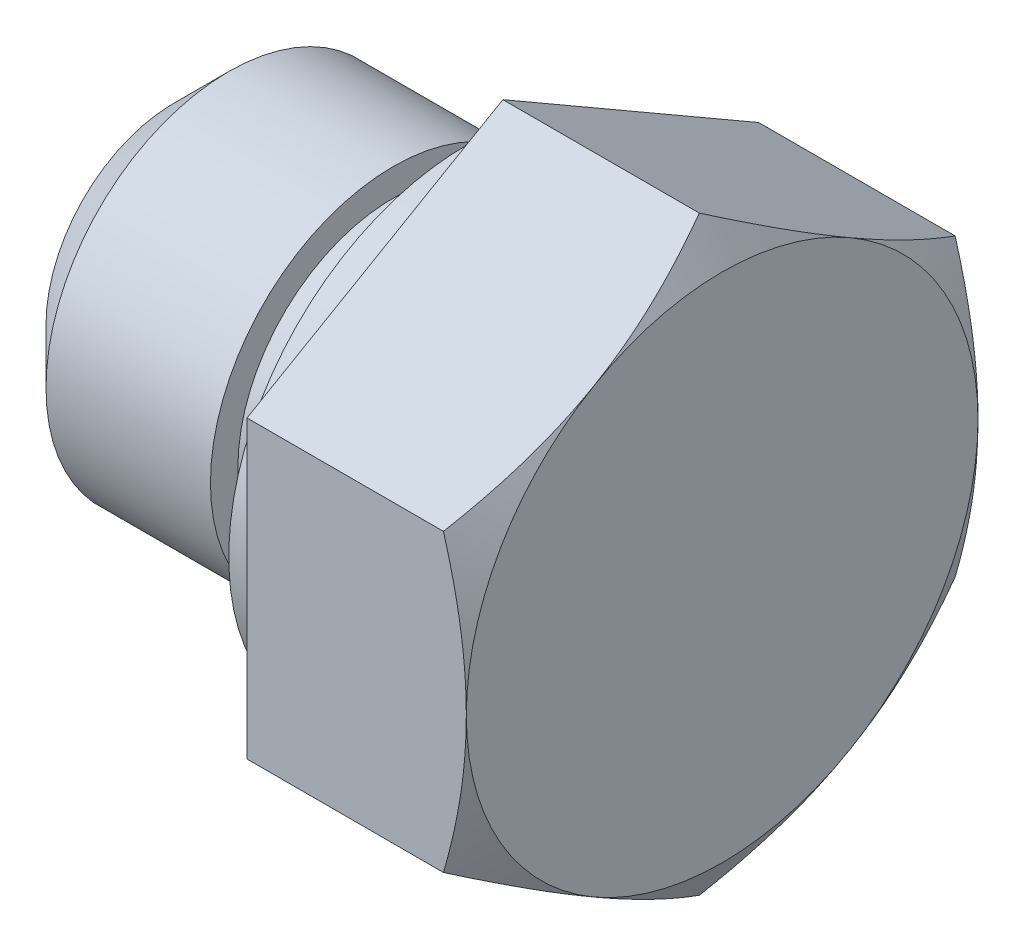
from build123d import *

# Parameters (mm, degrees)
EXTRUDE_1_DEPTH = 6
CHAMFER_1_SIZE  = 1.5


with BuildPart() as part:
    # 草图1 → 凸台-拉伸1 (new body)
    with BuildSketch(Plane(origin=(0, 0, 0), x_dir=(0, 0, -1), z_dir=(1, 0, 0))):
        Polygon((0, 8.082903769), (7, 4.041451884), (7, -4.041451884), (0, -8.082903769), (-7, -4.041451884), (-7, 4.041451884), align=None)
    extrude(amount=-EXTRUDE_1_DEPTH)

    # 草图3 → 旋转1 (revolve)
    with BuildSketch(Plane.XY, mode=Mode.PRIVATE) as revolve_1_sk:
        Polygon((-6, 6.5), (-7, 6.5), (-7, 4.25), (-9, 4.25), (-9, 5), (-15, 5), (-15, 0), (-6, 0), align=None)
    revolve(revolve_1_sk.sketch.rotate(Axis((10.611885909, 0, 0), (-1, 0, 0)), 90), axis=Axis((10.611885909, 0, 0), (-1, 0, 0)))

    # 草图4 → 切除-旋转1 (revolve, cut)
    with BuildSketch(Plane.XY):
        Polygon((0, -7), (-1.467666471, -9.542072896), (2.047412029, -9.542072896), align=None)
    revolve(axis=Axis((-15, 0, 0), (1, 0, 0)), mode=Mode.SUBTRACT)

    # 倒角1
    chamfer_1_edges = [part.edges().sort_by_distance(p)[0] for p in [
        (-15, 0, 5),
    ]]
    chamfer(chamfer_1_edges, length=CHAMFER_1_SIZE)


solid = part.part
